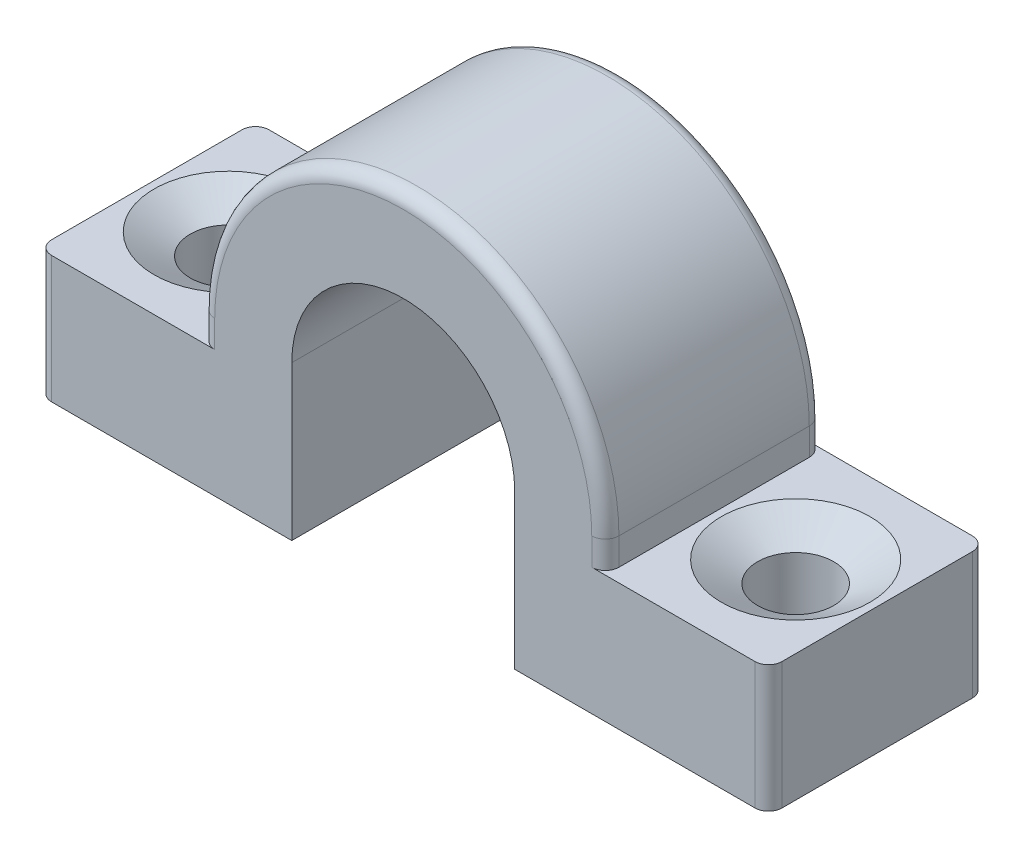
from build123d import *
from OCP.BRepFilletAPI import BRepFilletAPI_MakeChamfer

# Parameters (mm, degrees)
BOSS_EXTRUDE1_DEPTH = 12
SKETCH4_R           = 2.1
CUT_EXTRUDE1_DEPTH  = 27.646669586
CHAMFER1_SIZE       = 2
CHAMFER1_SIZE2      = 1.154700538
FILLET2_R           = 0.75


with BuildPart() as part:
    # Sketch1 → Boss-Extrude1 (new body)
    with BuildSketch(Plane.XY):
        with BuildLine():
            Line((-11.15, 0), (-11.15, -1.5))
            Line((-11.15, -1.5), (-20.15, -1.5))
            Line((-20.15, -1.5), (-20.15, -8.5))
            Line((-20.15, -8.5), (-6.15, -8.5))
            Line((-6.15, -8.5), (-6.15, 0))
            ThreePointArc((-6.15, 0), (0, 6.15), (6.15, 0))
            Line((6.15, 0), (6.15, -8.5))
            Line((6.15, -8.5), (20.15, -8.5))
            Line((20.15, -8.5), (20.15, -1.5))
            Line((20.15, -1.5), (11.15, -1.5))
            Line((11.15, -1.5), (11.15, 0))
            ThreePointArc((11.15, 0), (0, 11.15), (-11.15, 0))
        make_face()
    extrude(amount=BOSS_EXTRUDE1_DEPTH)

    # Sketch4 → Cut-Extrude1 (cut, through all)
    with BuildSketch(Plane(origin=(0, -1.5, 0), x_dir=(1, 0, 0), z_dir=(0, 1, 0))):
        with Locations(Location((-15.65, -6, 0), (0, 0, 180))):
            Circle(SKETCH4_R)
        with Locations(Location((15.65, -6, 0), (0, 0, 180))):
            Circle(SKETCH4_R)
    extrude(amount=-CUT_EXTRUDE1_DEPTH, mode=Mode.SUBTRACT)

    # Chamfer1: one chamfer whose edges measure the first distance from different faces: ONE call of the kernel's chamfer builder (chamfer() names one face for all edges)
    chamfer1_edges_1 = [part.edges().sort_by_distance(p)[0] for p in [
        (-13.55, -1.5, 6),
    ]]
    chamfer1_side_1 = [part.faces().sort_by_distance(p)[0] for p in [
        (-11.3, -1.5, 6),
    ]]
    chamfer1_edges_2 = [part.edges().sort_by_distance(p)[0] for p in [
        (17.75, -1.5, 6),
    ]]
    chamfer1_side_2 = [part.faces().sort_by_distance(p)[0] for p in [
        (20, -1.5, 6),
    ]]
    chamfer1 = BRepFilletAPI_MakeChamfer(part.part.solid().wrapped)
    for e in chamfer1_edges_1:
        chamfer1.Add(CHAMFER1_SIZE, CHAMFER1_SIZE2, e.wrapped, chamfer1_side_1[0].wrapped)  # the first distance lies on this face
    for e in chamfer1_edges_2:
        chamfer1.Add(CHAMFER1_SIZE, CHAMFER1_SIZE2, e.wrapped, chamfer1_side_2[0].wrapped)  # the first distance lies on this face
    add(Compound.cast(chamfer1.Shape()), mode=Mode.REPLACE)

    # Fillet2
    fillet2_edges = [part.edges().sort_by_distance(p)[0] for p in [
        (11.15, -0.75, 0),
        (20.15, -5, 0),
        (-20.15, -5, 0),
        (-11.15, -0.75, 0),
        (0, 11.15, 0),
        (-20.15, -5, 12),
        (20.15, -5, 12),
        (11.15, -0.75, 12),
        (0, 11.15, 12),
        (-11.15, -0.75, 12),
    ]]
    fillet(fillet2_edges, radius=FILLET2_R)


solid = part.part
